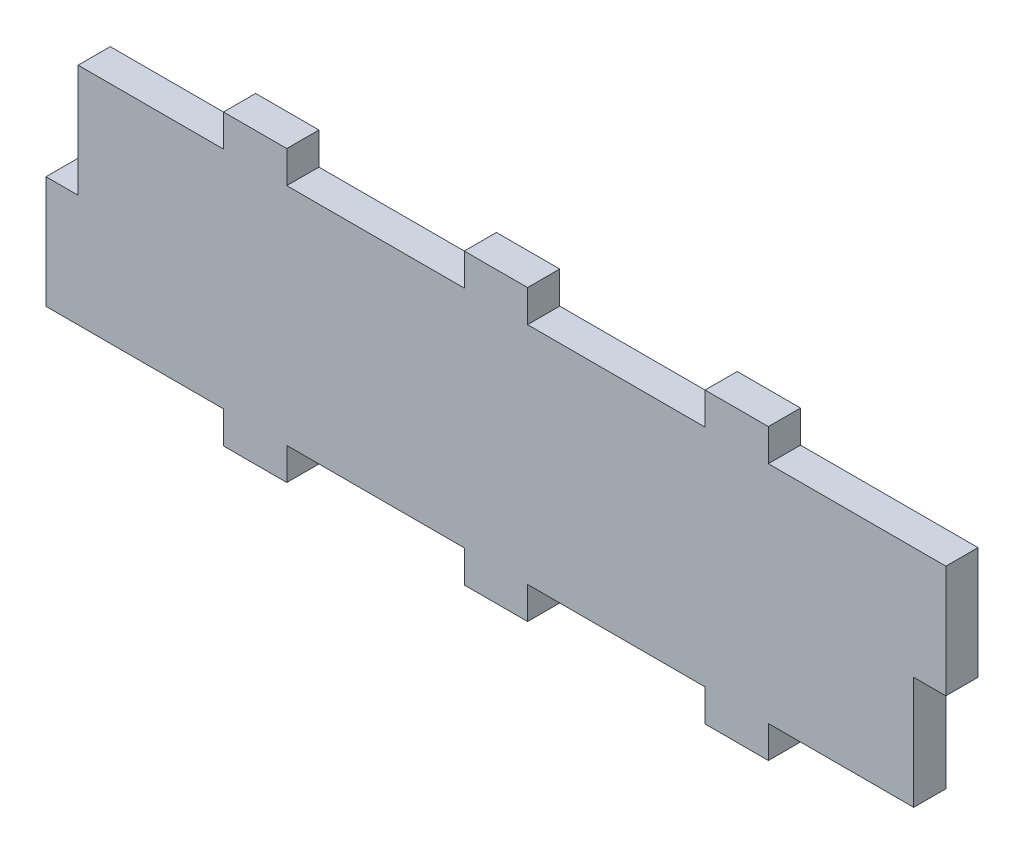
from build123d import *

# Parameters (mm, degrees)
SKETCH2_W           = 130
SKETCH2_H           = 35
SKETCH2_W_2         = 5
SKETCH2_H_2         = 17.475
SKETCH2_W_3         = 9.85
SKETCH2_H_3         = 5
BOSS_EXTRUDE1_DEPTH = 5


with BuildPart() as part:
    # Sketch2 → Boss-Extrude1 (new body)
    with BuildSketch(Plane.XY):
        Rectangle(SKETCH2_W, SKETCH2_H)
        with Locations((-67.5, -8.7625)):
            Rectangle(SKETCH2_W_2, SKETCH2_H_2)
        with Locations((-37.4625, 20)):
            Rectangle(SKETCH2_W_3, SKETCH2_H_3)
        with Locations((0, 20)):
            Rectangle(SKETCH2_W_3, SKETCH2_H_3)
        with Locations((37.4625, 20)):
            Rectangle(SKETCH2_W_3, SKETCH2_H_3)
        with Locations((67.5, 8.7625)):
            Rectangle(SKETCH2_W_2, SKETCH2_H_2)
        with Locations((37.4625, -20)):
            Rectangle(SKETCH2_W_3, SKETCH2_H_3)
        with Locations((0, -20)):
            Rectangle(SKETCH2_W_3, SKETCH2_H_3)
        with Locations((-37.4625, -20)):
            Rectangle(SKETCH2_W_3, SKETCH2_H_3)
    extrude(amount=BOSS_EXTRUDE1_DEPTH)


solid = part.part
